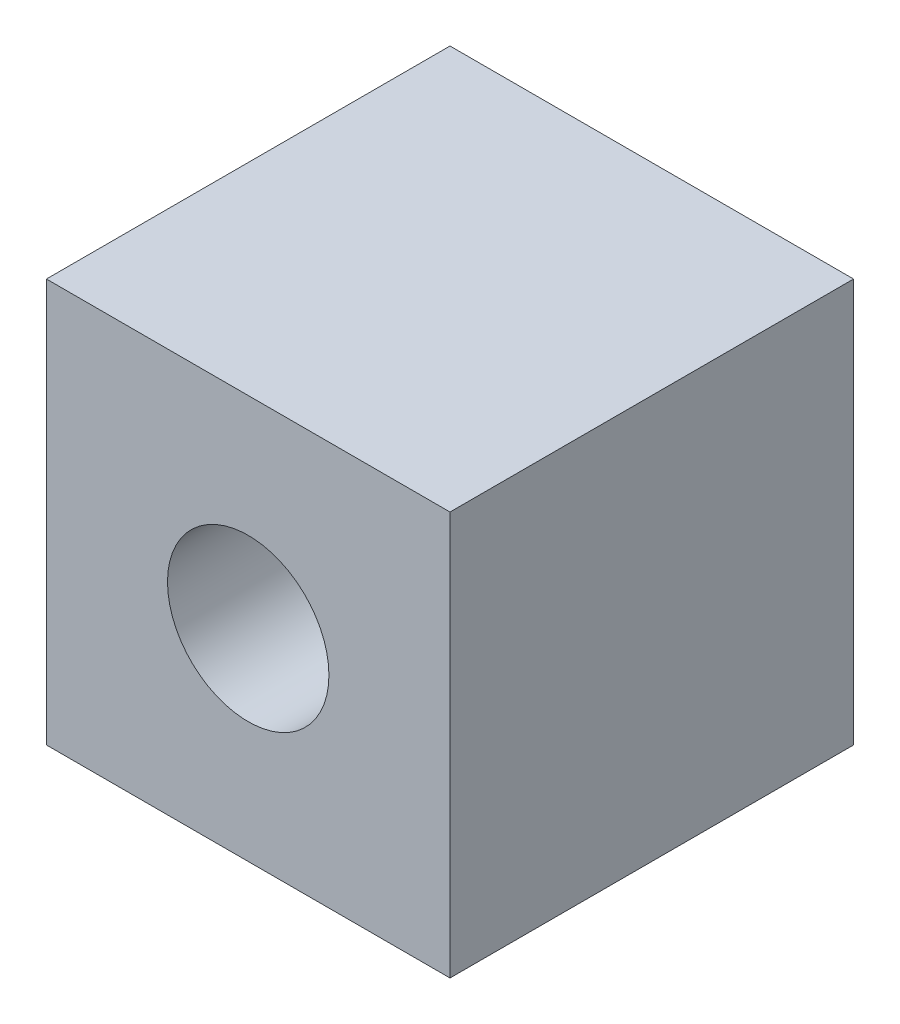
from build123d import *

# Parameters (mm, degrees)
SKETCH1_W           = 10
SKETCH1_H           = 10
BOSS_EXTRUDE1_DEPTH = 10
SKETCH2_R           = 2
CUT_EXTRUDE2_DEPTH  = 18.320508076


with BuildPart() as part:
    # Sketch1 → Boss-Extrude1 (new body)
    with BuildSketch(Plane.XY):
        with Locations((5, 5)):
            Rectangle(SKETCH1_W, SKETCH1_H)
    extrude(amount=BOSS_EXTRUDE1_DEPTH)

    # Sketch2 → Cut-Extrude2 (cut, through all)
    with BuildSketch(Plane.XY):
        with Locations((5, 5)):
            Circle(SKETCH2_R)
    extrude(amount=CUT_EXTRUDE2_DEPTH, mode=Mode.SUBTRACT)


solid = part.part
